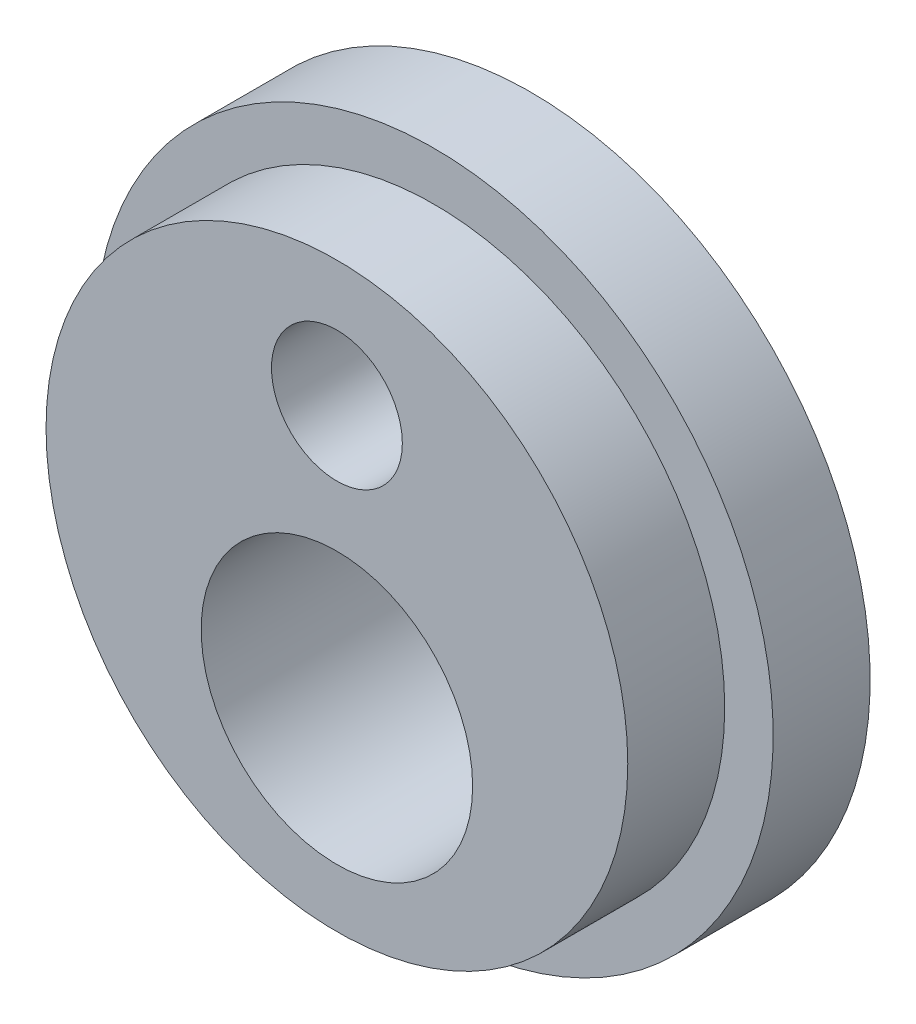
from build123d import *

# Parameters (mm, degrees)
SKETCH1_R               = 44.45
BOSS_EXTRUDE1_DEPTH     = 12.7
SKETCH2_R               = 38.1
BOSS_EXTRUDE2_DEPTH     = 12.7
CUT_EXTRUDE1_DEPTH      = 68.7994469
CUT_EXTRUDE1_DEPTH_BACK = 68.7994469
SKETCH3_R               = 8.5725
CUT_EXTRUDE3_DEPTH      = 68.7994469
CUT_EXTRUDE3_DEPTH_BACK = 68.7994469
SKETCH4_R               = 17.78
SKETCH5_R               = 3.175
CUT_EXTRUDE4_DEPTH      = 12.7


with BuildPart() as part:
    # Sketch1 → Boss-Extrude1 (new body)
    with BuildSketch(Plane.XY):
        Circle(SKETCH1_R)
    extrude(amount=BOSS_EXTRUDE1_DEPTH)

    # Sketch2 → Boss-Extrude2 (add)
    with BuildSketch(Plane.XY.offset(12.7)):
        Circle(SKETCH2_R)
    extrude(amount=BOSS_EXTRUDE2_DEPTH)

    # Sketch3 → Cut-Extrude1 (cut, two sides: drawn at the far end of the back side and taken through both)
    with BuildSketch(Plane.XY.offset(25.4).offset(-CUT_EXTRUDE1_DEPTH_BACK)):
        with Locations((0, 21.59)):
            Circle(SKETCH3_R)
    extrude(amount=CUT_EXTRUDE1_DEPTH + CUT_EXTRUDE1_DEPTH_BACK, mode=Mode.SUBTRACT)

    # Sketch4 → Cut-Extrude3 (cut, two sides: drawn at the far end of the back side and taken through both)
    with BuildSketch(Plane.XY.offset(25.4).offset(-CUT_EXTRUDE3_DEPTH_BACK)):
        with Locations((0, -12.7)):
            Circle(SKETCH4_R)
    extrude(amount=CUT_EXTRUDE3_DEPTH + CUT_EXTRUDE3_DEPTH_BACK, mode=Mode.SUBTRACT)

    # Sketch5 → Cut-Extrude4 (cut)
    with BuildSketch(Plane(origin=(0, 0, 0), x_dir=(-1, 0, 0), z_dir=(0, 0, -1))):
        with Locations((27.94, -12.7)):
            Circle(SKETCH5_R)
        with Locations((-27.94, -12.7)):
            Circle(SKETCH5_R)
    extrude(amount=-CUT_EXTRUDE4_DEPTH, mode=Mode.SUBTRACT)


solid = part.part
